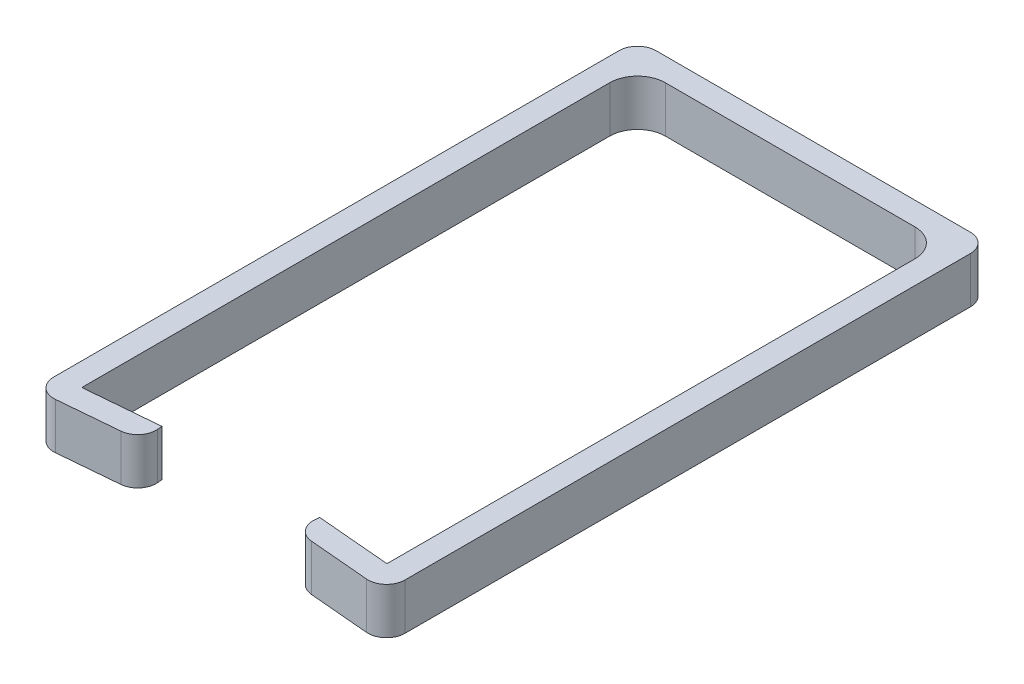
from build123d import *

# Parameters (mm, degrees)
BOSS_EXTRUDE1_DEPTH = 5
FILLET1_R           = 3
FILLET2_R           = 2


with BuildPart() as part:
    # Sketch2 → Boss-Extrude1 (new body)
    with BuildSketch(Plane(origin=(0, 0, 0), x_dir=(1, 0, 0), z_dir=(0, 1, 0))):
        Polygon((0, 0), (0, 60.1), (33, 60.1), (33, 0), (25.030442415, 0.697245942), (24.812553058, -1.793240803), (35.5, -2.728271253), (35.5, 62.6), (-2.5, 62.6), (-2.5, -2.728271253), (8.187446942, -1.793240803), (7.969557585, 0.697245942), align=None)
    extrude(amount=BOSS_EXTRUDE1_DEPTH)

    # Fillet1
    fillet1_edges = [part.edges().sort_by_distance(p)[0] for p in [
        (33, 2.5, -60.1),
        (0, 2.5, -60.1),
    ]]
    fillet(fillet1_edges, radius=FILLET1_R)

    # Fillet2
    fillet2_edges = [part.edges().sort_by_distance(p)[0] for p in [
        (8.187446942, 2.5, 1.793240803),
        (-2.5, 2.5, 2.728271253),
        (-2.5, 2.5, -62.6),
        (35.5, 2.5, -62.6),
        (35.5, 2.5, 2.728271253),
        (24.812553058, 2.5, 1.793240803),
    ]]
    fillet(fillet2_edges, radius=FILLET2_R)


solid = part.part
